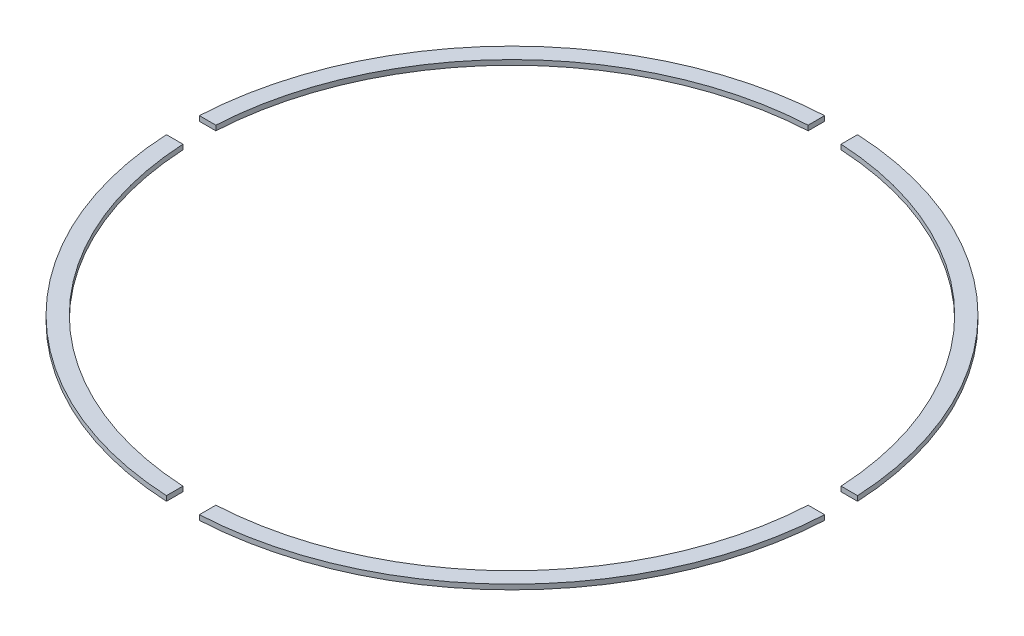
from build123d import *

# Parameters (mm, degrees)
SKETCH1_R            = 200
SKETCH1_R_2          = 190
BOSS_EXTRUDE1_DEPTH  = 1.5
QUADRUPLE_DEPTH      = 283.846689922
QUADRUPLE_DEPTH_BACK = 283.846689922
SKETCH4_W            = 20
SKETCH4_H            = 400
SKETCH4_W_2          = 400
SKETCH4_H_2          = 20


with BuildPart() as part:
    # Sketch1 → Boss-Extrude1 (new, symmetric)
    with BuildSketch(Plane(origin=(0, 0, 0), x_dir=(1, 0, 0), z_dir=(0, 1, 0))):
        Circle(SKETCH1_R)
        Circle(SKETCH1_R_2, mode=Mode.SUBTRACT)
    extrude(amount=BOSS_EXTRUDE1_DEPTH, both=True)

    # Sketch4 → quadruple (cut, two sides: drawn at the far end of the back side and taken through both)
    with BuildSketch(Plane(origin=(0, 0, 0), x_dir=(1, 0, 0), z_dir=(0, 1, 0)).offset(-QUADRUPLE_DEPTH_BACK)):
        Rectangle(SKETCH4_W, SKETCH4_H)
        Rectangle(SKETCH4_W_2, SKETCH4_H_2)
    extrude(amount=QUADRUPLE_DEPTH + QUADRUPLE_DEPTH_BACK, mode=Mode.SUBTRACT)


with BuildPart() as quadruple_piece_1:
    # of the separate pieces the step leaves, piece 1, a body of its own (quadruple_pieces)
    add(part.part.solids().sort_by_distance((199.749843554, -1.5, -10))[0])


with BuildPart() as quadruple_piece_2:
    # of the separate pieces the step leaves, piece 2, a body of its own (quadruple_pieces)
    add(part.part.solids().sort_by_distance((-10, 1.5, -199.749843554))[0])


with BuildPart() as quadruple_piece_3:
    # of the separate pieces the step leaves, piece 3, a body of its own (quadruple_pieces)
    add(part.part.solids().sort_by_distance((-199.749843554, 1.5, 10))[0])


with BuildPart() as quadruple_piece_4:
    # of the separate pieces the step leaves, piece 4, a body of its own (quadruple_pieces)
    add(part.part.solids().sort_by_distance((10, -1.5, 199.749843554))[0])


solid = Compound([quadruple_piece_1.part, quadruple_piece_2.part, quadruple_piece_3.part, quadruple_piece_4.part])
